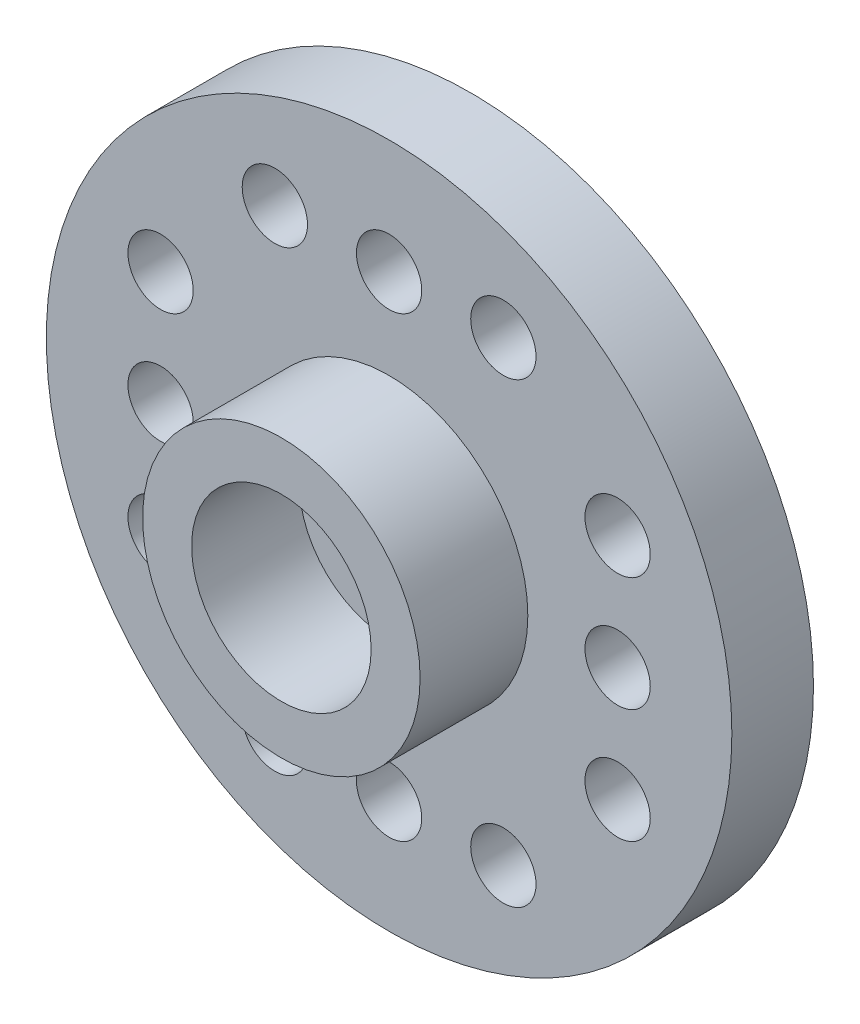
from build123d import *

# Parameters (mm, degrees)
SKETCH1_R           = 10.5
BOSS_EXTRUDE1_DEPTH = 2.5
SKETCH2_R           = 4.25
SKETCH2_R_2         = 2.75
BOSS_EXTRUDE2_DEPTH = 3.3
SKETCH3_R           = 1.5
CUT_EXTRUDE1_DEPTH  = 16.941769036
SKETCH3_3_R         = 4.7
SKETCH3_3_R_2       = 1.5
CUT_EXTRUDE2_DEPTH  = 1.2
SKETCH4_R           = 3.15
SKETCH4_R_2         = 3
BOSS_EXTRUDE3_DEPTH = 1.2
SKETCH5_R           = 1
CUT_EXTRUDE3_DEPTH  = 16.941769036


with BuildPart() as part:
    # Sketch1 → Boss-Extrude1 (new body)
    with BuildSketch(Plane.XY):
        Circle(SKETCH1_R)
    extrude(amount=BOSS_EXTRUDE1_DEPTH)

    # Sketch2 → Boss-Extrude2 (add)
    with BuildSketch(Plane.XY.offset(2.5)):
        Circle(SKETCH2_R)
        Circle(SKETCH2_R_2, mode=Mode.SUBTRACT)
    extrude(amount=BOSS_EXTRUDE2_DEPTH)

    # Sketch3 → Cut-Extrude1 (cut, through all)
    with BuildSketch(Plane(origin=(0, 0, 0), x_dir=(-1, 0, 0), z_dir=(0, 0, -1))):
        Circle(SKETCH3_R)
    extrude(amount=-CUT_EXTRUDE1_DEPTH, mode=Mode.SUBTRACT)

    # Sketch3<3> → Cut-Extrude2 (cut)
    with BuildSketch(Plane(origin=(0, 0, 0), x_dir=(-1, 0, 0), z_dir=(0, 0, -1))):
        Circle(SKETCH3_3_R)
        Circle(SKETCH3_3_R_2, mode=Mode.SUBTRACT)
    extrude(amount=-CUT_EXTRUDE2_DEPTH, mode=Mode.SUBTRACT)

    # Sketch4 → Boss-Extrude3 (add)
    with BuildSketch(Plane(origin=(0, 0, 1.2), x_dir=(-1, 0, 0), z_dir=(0, 0, -1))):
        Circle(SKETCH4_R)
        Circle(SKETCH4_R_2, mode=Mode.SUBTRACT)
    extrude(amount=BOSS_EXTRUDE3_DEPTH)

    # Sketch5 → Cut-Extrude3 (cut, through all)
    with BuildSketch(Plane(origin=(0, 0, 0), x_dir=(-1, 0, 0), z_dir=(0, 0, -1))):
        with Locations((0, 7)):
            Circle(SKETCH5_R)
        with Locations((0, -7)):
            Circle(SKETCH5_R)
        with Locations((-7, 0)):
            Circle(SKETCH5_R)
        with Locations((7, 0)):
            Circle(SKETCH5_R)
        with Locations((3.5, 7)):
            Circle(SKETCH5_R)
        with Locations((-3.5, 7)):
            Circle(SKETCH5_R)
        with Locations((-7, 3.5)):
            Circle(SKETCH5_R)
        with Locations((-7, -3.5)):
            Circle(SKETCH5_R)
        with Locations((7, -3.5)):
            Circle(SKETCH5_R)
        with Locations((7, 3.5)):
            Circle(SKETCH5_R)
        with Locations((-3.5, -7)):
            Circle(SKETCH5_R)
        with Locations((3.5, -7)):
            Circle(SKETCH5_R)
    extrude(amount=-CUT_EXTRUDE3_DEPTH, mode=Mode.SUBTRACT)


solid = part.part
